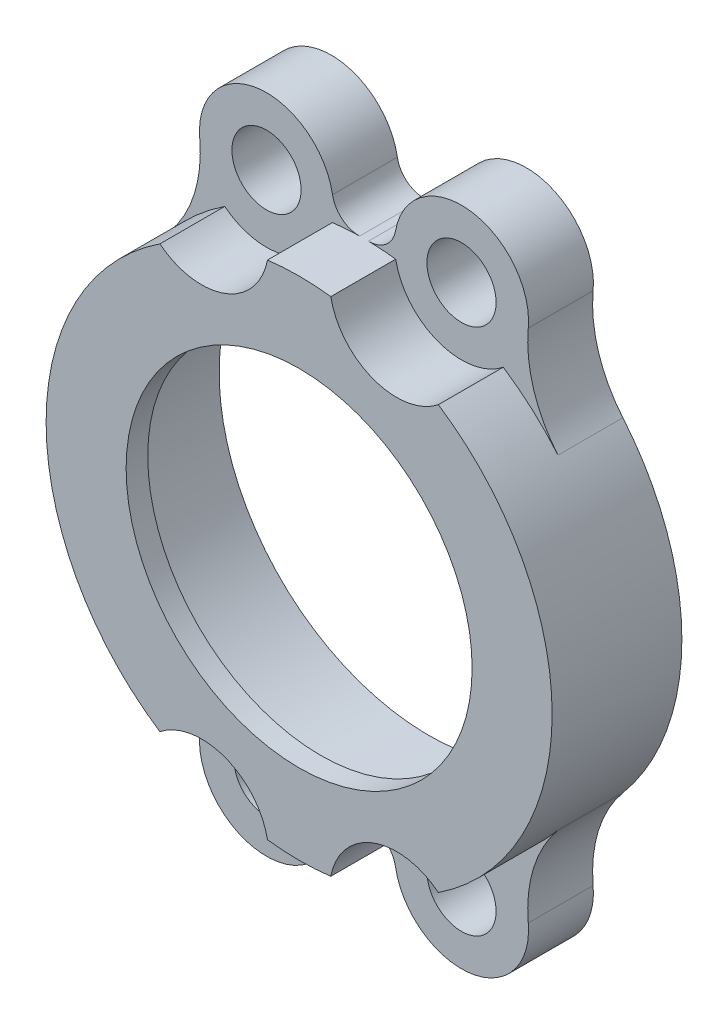
from build123d import *
from build123d.topology import SkipClean

# Parameters (mm, degrees)
SKETCH1_R           = 1.6
SKETCH1_R_2         = 9.7
SKETCH1_R_3         = 1.5
BOSS_EXTRUDE1_DEPTH = 5
BOSS_EXTRUDE2_START = 1
SKETCH1_3_R         = 8
BOSS_EXTRUDE2_DEPTH = 1
FILLET1_R           = 6
FILLET5_R           = 1.25
CUT_EXTRUDE1_START  = 1
CUT_EXTRUDE1_DEPTH  = 3


with BuildPart() as part:
    # Sketch1 → Boss-Extrude1 (new body)
    with BuildSketch(Plane.XY):
        with BuildLine():
            ThreePointArc((6.440028886, -9.768112814), (11.7, 0), (6.440028886, 9.768112814))
            ThreePointArc((6.440028886, 9.768112814), (5.583978873, 15.100635084), (1.464516076, 11.607979698))
            ThreePointArc((1.464516076, 11.607979698), (0, 11.7), (-1.464516076, 11.607979698))
            ThreePointArc((-1.464516076, 11.607979698), (-5.583978873, 15.100635084), (-6.440028886, 9.768112814))
            ThreePointArc((-6.440028886, 9.768112814), (-11.7, 0), (-6.440028886, -9.768112814))
            ThreePointArc((-6.440028886, -9.768112814), (-5.583978873, -15.100635084), (-1.464516076, -11.607979698))
            ThreePointArc((-1.464516076, -11.607979698), (0, -11.7), (1.464516076, -11.607979698))
            ThreePointArc((1.464516076, -11.607979698), (5.583978873, -15.100635084), (6.440028886, -9.768112814))
        make_face()
        with Locations((-4.508802817, 12.193059385)):
            Circle(SKETCH1_R, mode=Mode.SUBTRACT)
        with Locations((4.508802817, 12.193059385)):
            Circle(SKETCH1_R, mode=Mode.SUBTRACT)
        Circle(SKETCH1_R_2, mode=Mode.SUBTRACT)
        with Locations((4.508802817, -12.193059385)):
            Circle(SKETCH1_R, mode=Mode.SUBTRACT)
        with Locations((-4.508802817, -12.193059385)):
            Circle(SKETCH1_R_3, mode=Mode.SUBTRACT)
    extrude(amount=-BOSS_EXTRUDE1_DEPTH)

    # Sketch1<3> → Boss-Extrude2 (add)
    with BuildSketch(Plane.XY.offset(BOSS_EXTRUDE2_START)):
        with BuildLine():
            ThreePointArc((6.440028886, -9.768112814), (11.7, 0), (6.440028886, 9.768112814))
            ThreePointArc((6.440028886, 9.768112814), (3.433626761, 9.285483685), (1.464516076, 11.607979698))
            ThreePointArc((1.464516076, 11.607979698), (0, 11.7), (-1.464516076, 11.607979698))
            ThreePointArc((-1.464516076, 11.607979698), (-3.433626761, 9.285483685), (-6.440028886, 9.768112814))
            ThreePointArc((-6.440028886, 9.768112814), (-11.7, 0), (-6.440028886, -9.768112814))
            ThreePointArc((-6.440028886, -9.768112814), (-3.433626761, -9.285483685), (-1.464516076, -11.607979698))
            ThreePointArc((-1.464516076, -11.607979698), (0, -11.7), (1.464516076, -11.607979698))
            ThreePointArc((1.464516076, -11.607979698), (3.433626761, -9.285483685), (6.440028886, -9.768112814))
        make_face()
        Circle(SKETCH1_3_R, mode=Mode.SUBTRACT)
    extrude(amount=-BOSS_EXTRUDE2_DEPTH)

    # Fillet1
    fillet1_edges = [part.edges().sort_by_distance(p)[0] for p in [
        (-6.440028886, -9.768112814, -2.5),
        (-6.440028886, 9.768112814, -2.5),
        (6.440028886, 9.768112814, -2.5),
        (6.440028886, -9.768112814, -2.5),
    ]]
    fillet(fillet1_edges, radius=FILLET1_R)

    # Fillet5
    fillet5_edges = [part.edges().sort_by_distance(p)[0] for p in [
        (-1.464516076, 11.607979698, -2.5),
        (1.464516076, 11.607979698, -2.5),
        (1.464516076, -11.607979698, -2.5),
        (-1.464516076, -11.607979698, -2.5),
    ]]
    fillet(fillet5_edges, radius=FILLET5_R)

    # Sketch2 → Cut-Extrude1 (cut)
    with SkipClean():  # the faces are left unmerged after this step: merging them gives an invalid solid
        with BuildSketch(Plane.XY.offset(CUT_EXTRUDE1_START)):
            with BuildLine():
                ThreePointArc((-1.464516076, -11.607979698), (-3.433626761, -9.285483685), (-6.440028886, -9.768112814))
                ThreePointArc((-6.440028886, -9.768112814), (-7.78749678, -8.731832219), (-8.970582034, -7.511235449))
                ThreePointArc((-8.970582034, -7.511235449), (-7.843991966, -9.57352888), (-7.59588423, -11.910343363))
                ThreePointArc((-7.59588423, -11.910343363), (-4.919534521, -15.265729147), (-1.455850964, -12.73109747))
                ThreePointArc((-1.455850964, -12.73109747), (-1.020006813, -11.983589345), (-0.203121026, -11.698236698))
                ThreePointArc((-0.203121026, -11.698236698), (-0.835038896, -11.67016324), (-1.464516076, -11.607979698))
            make_face()
            with BuildLine():
                ThreePointArc((6.440028886, -9.768112814), (3.433626761, -9.285483685), (1.464516076, -11.607979698))
                ThreePointArc((1.464516076, -11.607979698), (0.835038896, -11.67016324), (0.203121026, -11.698236698))
                ThreePointArc((0.203121026, -11.698236698), (1.020006813, -11.983589345), (1.455850964, -12.73109747))
                ThreePointArc((1.455850964, -12.73109747), (4.919534521, -15.265729147), (7.59588423, -11.910343363))
                ThreePointArc((7.59588423, -11.910343363), (7.843991966, -9.57352888), (8.970582034, -7.511235449))
                ThreePointArc((8.970582034, -7.511235449), (7.78749678, -8.731832219), (6.440028886, -9.768112814))
            make_face()
            with BuildLine():
                ThreePointArc((-6.440028886, 9.768112814), (-3.433626761, 9.285483685), (-1.464516076, 11.607979698))
                ThreePointArc((-1.464516076, 11.607979698), (-0.835038896, 11.67016324), (-0.203121026, 11.698236698))
                ThreePointArc((-0.203121026, 11.698236698), (-1.020006813, 11.983589345), (-1.455850964, 12.73109747))
                ThreePointArc((-1.455850964, 12.73109747), (-4.919534521, 15.265729147), (-7.59588423, 11.910343363))
                ThreePointArc((-7.59588423, 11.910343363), (-7.843991966, 9.57352888), (-8.970582034, 7.511235449))
                ThreePointArc((-8.970582034, 7.511235449), (-7.78749678, 8.731832219), (-6.440028886, 9.768112814))
            make_face()
            with BuildLine():
                ThreePointArc((1.464516076, 11.607979698), (3.433626761, 9.285483685), (6.440028886, 9.768112814))
                ThreePointArc((6.440028886, 9.768112814), (7.78749678, 8.731832219), (8.970582034, 7.511235449))
                ThreePointArc((8.970582034, 7.511235449), (7.843991966, 9.57352888), (7.59588423, 11.910343363))
                ThreePointArc((7.59588423, 11.910343363), (4.919534521, 15.265729147), (1.455850964, 12.73109747))
                ThreePointArc((1.455850964, 12.73109747), (1.020006813, 11.983589345), (0.203121026, 11.698236698))
                ThreePointArc((0.203121026, 11.698236698), (0.835038896, 11.67016324), (1.464516076, 11.607979698))
            make_face()
        extrude(amount=-CUT_EXTRUDE1_DEPTH, mode=Mode.SUBTRACT)


solid = part.part
